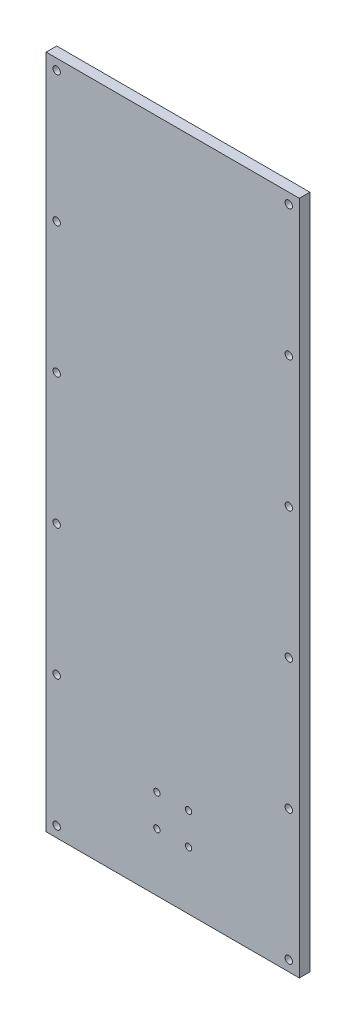
from build123d import *

# Parameters (mm, degrees)
ESQUISSE1_W             = 120
ESQUISSE1_H             = 320
BOSS_EXTRU_1_DEPTH      = 5
ESQUISSE2_R             = 1.747592995
ESQUISSE2_R_2           = 1.5
ENL_V_MAT_EXTRU_1_DEPTH = 10


with BuildPart() as part:
    # Esquisse1 → Boss.-Extru.1 (new body)
    with BuildSketch(Plane.XY):
        Rectangle(ESQUISSE1_W, ESQUISSE1_H)
    extrude(amount=BOSS_EXTRU_1_DEPTH)

    # Esquisse2 → Enlèv. mat.-Extru.1 (cut)
    with BuildSketch(Plane.XY.offset(5)):
        with Locations((-55, 155)):
            Circle(ESQUISSE2_R)
        with Locations((55, 155)):
            Circle(ESQUISSE2_R)
        with Locations((-55, 93)):
            Circle(ESQUISSE2_R)
        with Locations((-55, 31)):
            Circle(ESQUISSE2_R)
        with Locations((-55, -31)):
            Circle(ESQUISSE2_R)
        with Locations((-55, -93)):
            Circle(ESQUISSE2_R)
        with Locations((-55, -155)):
            Circle(ESQUISSE2_R)
        with Locations((55, 93)):
            Circle(ESQUISSE2_R)
        with Locations((55, 31)):
            Circle(ESQUISSE2_R)
        with Locations((55, -31)):
            Circle(ESQUISSE2_R)
        with Locations((55, -93)):
            Circle(ESQUISSE2_R)
        with Locations((-7.5, -117.5)):
            Circle(ESQUISSE2_R_2)
        with Locations((7.5, -117.5)):
            Circle(ESQUISSE2_R_2)
        with Locations((7.5, -132.5)):
            Circle(ESQUISSE2_R_2)
        with Locations((-7.5, -132.5)):
            Circle(ESQUISSE2_R_2)
        with Locations((55, -155)):
            Circle(ESQUISSE2_R)
    extrude(amount=-ENL_V_MAT_EXTRU_1_DEPTH, mode=Mode.SUBTRACT)


solid = part.part
